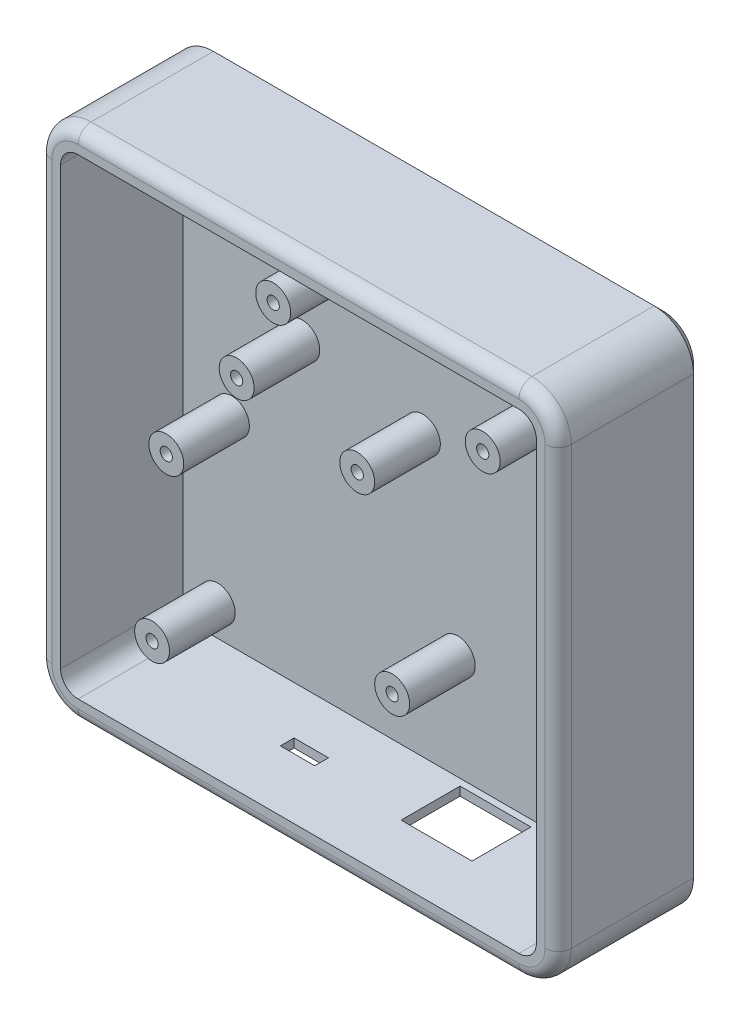
from build123d import *
from OCP.BRepFilletAPI import BRepFilletAPI_MakeChamfer

# Parameters (mm, degrees)
BOSS_EXTRUDE1_DEPTH   = 28
SKETCH2_R             = 4
BOSS_EXTRUDE2_DEPTH   = 15.044559182
BOSS_EXTRUDE2_2_DEPTH = 15.044559182
BOSS_EXTRUDE2_3_DEPTH = 15.044559182
BOSS_EXTRUDE2_4_DEPTH = 15.044559182
BOSS_EXTRUDE2_5_DEPTH = 15.044559182
BOSS_EXTRUDE2_6_DEPTH = 15.044559182
BOSS_EXTRUDE2_7_DEPTH = 15.044559182
BOSS_EXTRUDE2_8_DEPTH = 15.044559182
BOSS_EXTRUDE4_DEPTH   = 5
CHAMFER1_SIZE         = 2
SKETCH8_W             = 7.884776493
SKETCH8_H             = 3.144261004
CUT_EXTRUDE4_DEPTH    = 10
CUT_EXTRUDE5_START    = -15.044562
SKETCH9_R             = 1.4
CUT_EXTRUDE5_DEPTH    = 15.044563
FILLET1_R             = 3
CHAMFER2_SIZE         = 3
CHAMFER2_SIZE2        = 4.28444402


with BuildPart() as part:
    # Sketch1 → Boss-Extrude1 (new body)
    with BuildSketch(Plane.XY):
        with BuildLine():
            Line((23.631203293, 52.499999142), (23.631198922, -47.500000858))
            ThreePointArc((23.631198922, -47.500000858), (26.267237752, -53.863962143), (32.631198922, -56.500001252))
            Line((32.631198922, -56.500001252), (133.631203293, -56.500001252))
            ThreePointArc((133.631203293, -56.500001252), (139.995164324, -53.863962282), (142.631203293, -47.500001252))
            Line((142.631203293, -47.500001252), (142.631203293, 52.499998748))
            ThreePointArc((142.631203293, 52.499998748), (139.995164324, 58.863959779), (133.631203293, 61.499998748))
            Line((133.631203293, 61.499998748), (32.631203293, 61.499998748))
            ThreePointArc((32.631203293, 61.499998748), (26.267242401, 58.863959918), (23.631203293, 52.499999142))
        make_face()
        with BuildLine():
            Line((28.631203141, 52.499998748), (28.63119877, -47.500001252))
            ThreePointArc((28.63119877, -47.500001252), (29.80277169, -50.328428483), (32.631198922, -51.500001252))
            Line((32.631198922, -51.500001252), (133.631203293, -51.500001252))
            ThreePointArc((133.631203293, -51.500001252), (136.459630418, -50.328428376), (137.631203293, -47.500001252))
            Line((137.631203293, -47.500001252), (137.631203293, 52.499998748))
            ThreePointArc((137.631203293, 52.499998748), (136.459630418, 55.328425873), (133.631203293, 56.499998748))
            Line((133.631203293, 56.499998748), (32.631203293, 56.499998748))
            ThreePointArc((32.631203293, 56.499998748), (29.802776168, 55.328425873), (28.631203141, 52.499998748))
        make_face(mode=Mode.SUBTRACT)
    extrude(amount=-BOSS_EXTRUDE1_DEPTH)

    # Sketch6 → Boss-Extrude4 (add)
    with BuildSketch(Plane(origin=(0, 0, -28), x_dir=(-1, 0, 0), z_dir=(0, 0, -1))):
        with BuildLine():
            Line((-23.631198922, -47.500000858), (-23.631203293, 52.499999142))
            ThreePointArc((-23.631203293, 52.499999142), (-26.267242401, 58.863959918), (-32.631203293, 61.499998748))
            Line((-32.631203293, 61.499998748), (-133.631203293, 61.499998748))
            ThreePointArc((-133.631203293, 61.499998748), (-139.995164324, 58.863959779), (-142.631203293, 52.499998748))
            Line((-142.631203293, 52.499998748), (-142.631203293, -47.500001252))
            ThreePointArc((-142.631203293, -47.500001252), (-139.995164324, -53.863962282), (-133.631203293, -56.500001252))
            Line((-133.631203293, -56.500001252), (-32.631198922, -56.500001252))
            ThreePointArc((-32.631198922, -56.500001252), (-26.267237752, -53.863962143), (-23.631198922, -47.500000858))
        make_face()
    extrude(amount=BOSS_EXTRUDE4_DEPTH)

    # Chamfer1
    chamfer1_edges = [part.edges().sort_by_distance(p)[0] for p in [
        (26.267237752, -53.863962143, -33),
        (23.631201107, 2.499999142, -33),
        (26.267242401, 58.863959918, -33),
        (83.131203293, 61.499998748, -33),
        (139.995164324, 58.863959779, -33),
        (142.631203293, 2.499998748, -33),
        (139.995164324, -53.863962282, -33),
        (83.131201107, -56.500001252, -33),
    ]]
    chamfer(chamfer1_edges, length=CHAMFER1_SIZE)

    # Sketch8 → Cut-Extrude4 (cut)
    with BuildSketch(Plane(origin=(0, -56.500001252, 0), x_dir=(1, 0, 0), z_dir=(0, 1, 0))):
        Polygon((93.682427273, 26.464704917), (109.927414178, 26.464704917), (109.927414178, 12.955440885), (93.687414178, 12.955440885), align=None)
        with Locations((69.057611753, 15.427869498)):
            Rectangle(SKETCH8_W, SKETCH8_H)
    extrude(amount=CUT_EXTRUDE4_DEPTH, mode=Mode.SUBTRACT)

    # Fillet1
    fillet1_edges = [part.edges().sort_by_distance(p)[0] for p in [
        (142.631203293, 2.499998748, 0),
        (139.995164324, -53.863962282, 0),
        (83.131201107, -56.500001252, 0),
        (26.267237752, -53.863962143, 0),
        (23.631201107, 2.499999142, 0),
        (26.267242401, 58.863959918, 0),
        (83.131203293, 61.499998748, 0),
        (139.995164324, 58.863959779, 0),
    ]]
    fillet(fillet1_edges, radius=FILLET1_R)

    # Chamfer2: one chamfer whose edges measure the first distance from different faces: ONE call of the kernel's chamfer builder (chamfer() names one face for all edges)
    chamfer2_edges_1 = [part.edges().sort_by_distance(p)[0] for p in [
        (93.684920726, -56.500001252, -19.710072901),
    ]]
    chamfer2_side_1 = [part.faces().sort_by_distance(p)[0] for p in [
        (93.684920726, -54.000001252, -19.710072901),
    ]]
    chamfer2_edges_2 = [part.edges().sort_by_distance(p)[0] for p in [
        (101.807414178, -56.500001252, -12.955440885),
    ]]
    chamfer2_side_2 = [part.faces().sort_by_distance(p)[0] for p in [
        (101.807414178, -54.000001252, -12.955440885),
    ]]
    chamfer2_edges_3 = [part.edges().sort_by_distance(p)[0] for p in [
        (109.927414178, -56.500001252, -19.710072901),
    ]]
    chamfer2_side_3 = [part.faces().sort_by_distance(p)[0] for p in [
        (109.927414178, -54.000001252, -19.710072901),
    ]]
    chamfer2_edges_4 = [part.edges().sort_by_distance(p)[0] for p in [
        (101.804920726, -56.500001252, -26.464704917),
    ]]
    chamfer2_side_4 = [part.faces().sort_by_distance(p)[0] for p in [
        (101.804920726, -54.000001252, -26.464704917),
    ]]
    chamfer2_edges_5 = [part.edges().sort_by_distance(p)[0] for p in [
        (65.115223507, -56.500001252, -15.427869498),
    ]]
    chamfer2_side_5 = [part.faces().sort_by_distance(p)[0] for p in [
        (65.115223507, -54.000001252, -15.427869498),
    ]]
    chamfer2_edges_6 = [part.edges().sort_by_distance(p)[0] for p in [
        (69.057611754, -56.500001252, -13.855738996),
    ]]
    chamfer2_side_6 = [part.faces().sort_by_distance(p)[0] for p in [
        (69.057611754, -54.000001252, -13.855738996),
    ]]
    chamfer2_edges_7 = [part.edges().sort_by_distance(p)[0] for p in [
        (73, -56.500001252, -15.427869498),
    ]]
    chamfer2_side_7 = [part.faces().sort_by_distance(p)[0] for p in [
        (73, -54.000001252, -15.427869498),
    ]]
    chamfer2_edges_8 = [part.edges().sort_by_distance(p)[0] for p in [
        (69.057611754, -56.500001252, -17),
    ]]
    chamfer2_side_8 = [part.faces().sort_by_distance(p)[0] for p in [
        (69.057611754, -54.000001252, -17),
    ]]
    chamfer2 = BRepFilletAPI_MakeChamfer(part.part.solid().wrapped)
    for e in chamfer2_edges_1:
        chamfer2.Add(CHAMFER2_SIZE, CHAMFER2_SIZE2, e.wrapped, chamfer2_side_1[0].wrapped)  # the first distance lies on this face
    for e in chamfer2_edges_2:
        chamfer2.Add(CHAMFER2_SIZE, CHAMFER2_SIZE2, e.wrapped, chamfer2_side_2[0].wrapped)  # the first distance lies on this face
    for e in chamfer2_edges_3:
        chamfer2.Add(CHAMFER2_SIZE, CHAMFER2_SIZE2, e.wrapped, chamfer2_side_3[0].wrapped)  # the first distance lies on this face
    for e in chamfer2_edges_4:
        chamfer2.Add(CHAMFER2_SIZE, CHAMFER2_SIZE2, e.wrapped, chamfer2_side_4[0].wrapped)  # the first distance lies on this face
    for e in chamfer2_edges_5:
        chamfer2.Add(CHAMFER2_SIZE, CHAMFER2_SIZE2, e.wrapped, chamfer2_side_5[0].wrapped)  # the first distance lies on this face
    for e in chamfer2_edges_6:
        chamfer2.Add(CHAMFER2_SIZE, CHAMFER2_SIZE2, e.wrapped, chamfer2_side_6[0].wrapped)  # the first distance lies on this face
    for e in chamfer2_edges_7:
        chamfer2.Add(CHAMFER2_SIZE, CHAMFER2_SIZE2, e.wrapped, chamfer2_side_7[0].wrapped)  # the first distance lies on this face
    for e in chamfer2_edges_8:
        chamfer2.Add(CHAMFER2_SIZE, CHAMFER2_SIZE2, e.wrapped, chamfer2_side_8[0].wrapped)  # the first distance lies on this face
    add(Compound.cast(chamfer2.Shape()), mode=Mode.REPLACE)


with BuildPart() as body_2:
    # Sketch2 → Boss-Extrude2 (new body)
    with BuildSketch(Plane(origin=(0, 0, -28), x_dir=(-1, 0, 0), z_dir=(0, 0, -1))):
        with Locations((-112.381202333, 30.999995568)):
            Circle(SKETCH2_R)
    extrude(amount=-BOSS_EXTRUDE2_DEPTH)


with BuildPart() as body_3:
    # Sketch2 → Boss-Extrude2 2 (new body)
    with BuildSketch(Plane(origin=(0, 0, -28), x_dir=(-1, 0, 0), z_dir=(0, 0, -1))):
        with Locations((-64.381202053, 36.499996826)):
            Circle(SKETCH2_R)
    extrude(amount=-BOSS_EXTRUDE2_2_DEPTH)


with BuildPart() as body_4:
    # Sketch2 → Boss-Extrude2 3 (new body)
    with BuildSketch(Plane(origin=(0, 0, -28), x_dir=(-1, 0, 0), z_dir=(0, 0, -1))):
        with Locations((-56.006201457, 17.374998612)):
            Circle(SKETCH2_R)
    extrude(amount=-BOSS_EXTRUDE2_3_DEPTH)


with BuildPart() as body_5:
    # Sketch2 → Boss-Extrude2 4 (new body)
    with BuildSketch(Plane(origin=(0, 0, -28), x_dir=(-1, 0, 0), z_dir=(0, 0, -1))):
        with Locations((-83.631200604, 12.499995724)):
            Circle(SKETCH2_R)
    extrude(amount=-BOSS_EXTRUDE2_4_DEPTH)


with BuildPart() as body_6:
    # Sketch2 → Boss-Extrude2 5 (new body)
    with BuildSketch(Plane(origin=(0, 0, -28), x_dir=(-1, 0, 0), z_dir=(0, 0, -1))):
        with Locations((-39.881200947, -5.750001423)):
            Circle(SKETCH2_R)
    extrude(amount=-BOSS_EXTRUDE2_5_DEPTH)


with BuildPart() as body_7:
    # Sketch2 → Boss-Extrude2 6 (new body)
    with BuildSketch(Plane(origin=(0, 0, -28), x_dir=(-1, 0, 0), z_dir=(0, 0, -1))):
        with Locations((-36.631198133, -44.500002521)):
            Circle(SKETCH2_R)
    extrude(amount=-BOSS_EXTRUDE2_6_DEPTH)


with BuildPart() as body_8:
    # Sketch2 → Boss-Extrude2 7 (new body)
    with BuildSketch(Plane(origin=(0, 0, -28), x_dir=(-1, 0, 0), z_dir=(0, 0, -1))):
        with Locations((-130.631198093, -44.50000663)):
            Circle(SKETCH2_R)
    extrude(amount=-BOSS_EXTRUDE2_7_DEPTH)


with BuildPart() as body_9:
    # Sketch2 → Boss-Extrude2 8 (new body)
    with BuildSketch(Plane(origin=(0, 0, -28), x_dir=(-1, 0, 0), z_dir=(0, 0, -1))):
        with Locations((-91.631200636, -27.500003365)):
            Circle(SKETCH2_R)
    extrude(amount=-BOSS_EXTRUDE2_8_DEPTH)


with BuildPart() as cut_extrude5_tool:
    # Sketch9 → Cut-Extrude5 (new body)
    with BuildSketch(Plane(origin=(-5.66e-07, 0, -12.95543608), x_dir=(0.999999999999999, 0, -4.371138828673993e-08), z_dir=(4.371138828673993e-08, -1.389432378091647e-15, 0.9999999999999991)).offset(CUT_EXTRUDE5_START)):
        with Locations((130.631198659, -44.50000663)):
            Circle(SKETCH9_R)
        with Locations((36.631198699, -44.500002521)):
            Circle(SKETCH9_R)
        with Locations((91.631201202, -27.500003365)):
            Circle(SKETCH9_R)
        with Locations((83.631201171, 12.499995724)):
            Circle(SKETCH9_R)
        with Locations((56.006202024, 17.374998612)):
            Circle(SKETCH9_R)
        with Locations((39.881201513, -5.750001423)):
            Circle(SKETCH9_R)
        with Locations((112.381202899, 30.999995568)):
            Circle(SKETCH9_R)
        with Locations((64.38120262, 36.499996826)):
            Circle(SKETCH9_R)
    extrude(amount=CUT_EXTRUDE5_DEPTH)


with BuildPart() as body_2_1:
    add(body_2.part)

    # Cut-Extrude5: cut by cut_extrude5_tool
    add(cut_extrude5_tool.part, mode=Mode.SUBTRACT)


with BuildPart() as body_3_1:
    add(body_3.part)

    # Cut-Extrude5: cut by cut_extrude5_tool
    add(cut_extrude5_tool.part, mode=Mode.SUBTRACT)


with BuildPart() as body_4_1:
    add(body_4.part)

    # Cut-Extrude5: cut by cut_extrude5_tool
    add(cut_extrude5_tool.part, mode=Mode.SUBTRACT)


with BuildPart() as body_5_1:
    add(body_5.part)

    # Cut-Extrude5: cut by cut_extrude5_tool
    add(cut_extrude5_tool.part, mode=Mode.SUBTRACT)


with BuildPart() as body_6_1:
    add(body_6.part)

    # Cut-Extrude5: cut by cut_extrude5_tool
    add(cut_extrude5_tool.part, mode=Mode.SUBTRACT)


with BuildPart() as body_7_1:
    add(body_7.part)

    # Cut-Extrude5: cut by cut_extrude5_tool
    add(cut_extrude5_tool.part, mode=Mode.SUBTRACT)


with BuildPart() as body_8_1:
    add(body_8.part)

    # Cut-Extrude5: cut by cut_extrude5_tool
    add(cut_extrude5_tool.part, mode=Mode.SUBTRACT)


with BuildPart() as body_9_1:
    add(body_9.part)

    # Cut-Extrude5: cut by cut_extrude5_tool
    add(cut_extrude5_tool.part, mode=Mode.SUBTRACT)


solid = Compound([part.part, body_2_1.part, body_3_1.part, body_4_1.part, body_5_1.part, body_6_1.part, body_7_1.part, body_8_1.part, body_9_1.part])
